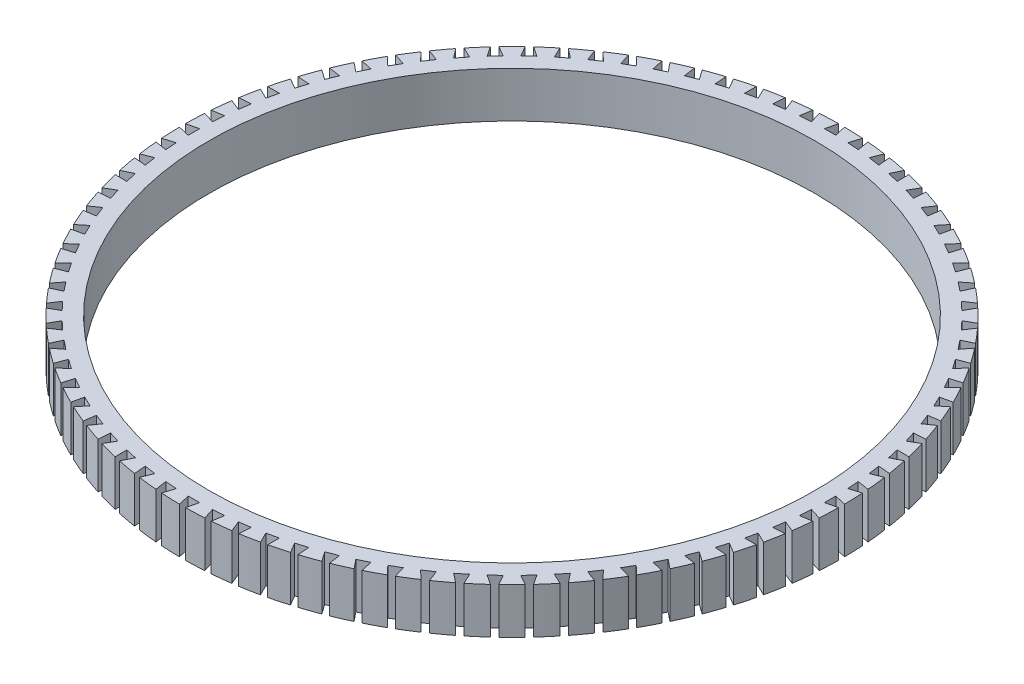
from build123d import *

# Parameters (mm, degrees)
SKETCH1_R           = 39.7
SKETCH1_R_2         = 36.5
BOSS_EXTRUDE1_DEPTH = 5.5
CUT_EXTRUDE1_DEPTH  = 57.41303041
CIRPATTERN1_COUNT   = 84


with BuildPart() as part:
    # Sketch1 → Boss-Extrude1 (new body)
    with BuildSketch(Plane(origin=(0, 0, 0), x_dir=(1, 0, 0), z_dir=(0, 1, 0))):
        with Locations(Location((0, 0, 0), (0, 0, 270))):
            Circle(SKETCH1_R)
        with Locations(Location((0, 0, 0), (0, 0, 270))):
            Circle(SKETCH1_R_2, mode=Mode.SUBTRACT)
    extrude(amount=BOSS_EXTRUDE1_DEPTH)

    # Sketch2 → Cut-Extrude1 (cut, through all)
    with BuildSketch(Plane(origin=(0, 0, 0), x_dir=(1, 0, 0), z_dir=(0, 1, 0))):
        Polygon((0.684684655, 38.324655601), (-0.684684655, 38.324655601), (-0.359045792, 39.7), (-0.359045792, 41.552836496), (0.359045792, 41.552836496), (0.359045792, 39.7), align=None)
    cut_extrude1 = extrude(amount=CUT_EXTRUDE1_DEPTH, mode=Mode.SUBTRACT)

    # CirPattern1: Cut-Extrude1 ×84 about axis
    cirpattern1_axis = Axis((0, 0, 0), (0, 1, 0))
    for i in range(1, CIRPATTERN1_COUNT):
        add(cut_extrude1.rotate(cirpattern1_axis, i * 360 / CIRPATTERN1_COUNT), mode=Mode.SUBTRACT)


solid = part.part
